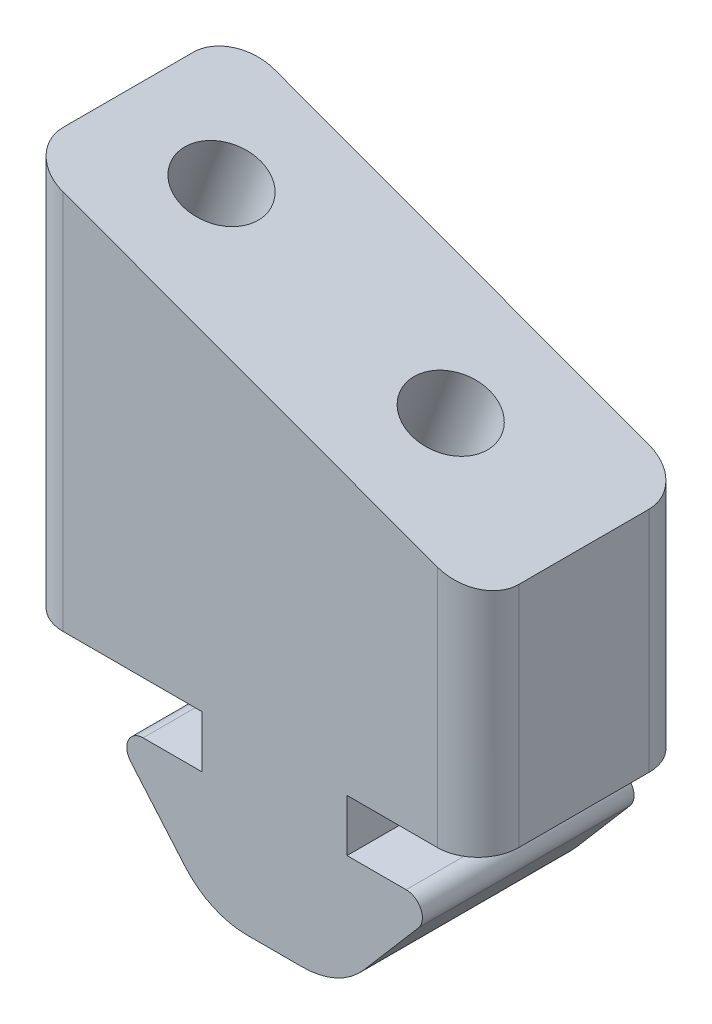
from build123d import *

# Parameters (mm, degrees)
BOSS_EXTRUDE3_DEPTH = 13
FILLET1_R           = 1
FILLET2_R           = 5
SKETCH2_R           = 2.4
CUT_EXTRUDE1_DEPTH  = 7.5
FILLET3_R           = 2.5


with BuildPart() as part:
    # Sketch1 → Boss-Extrude3 (new body)
    with BuildSketch(Plane.XY):
        Polygon((-12.5, 10.5), (-4.45, 10.5), (4.45, 10.5), (12.5, 10.5), (12.5, 24.5), (-12.5, 33.7), align=None)
        Polygon((-4.45, 7.3), (-10.25, 7.3), (-4, 0), (4, 0), (10.25, 7.3), (4.45, 7.3), (4.45, 10.5), (-4.45, 10.5), align=None)
        Polygon((-15.5, 34.804), (-12.5, 33.7), (-12.5, 10.5), (-15.5, 10.5), align=None)
    extrude(amount=BOSS_EXTRUDE3_DEPTH)

    # Fillet1
    fillet1_edges = [part.edges().sort_by_distance(p)[0] for p in [
        (10.25, 7.3, 6.5),
        (-10.25, 7.3, 6.5),
    ]]
    fillet(fillet1_edges, radius=FILLET1_R)

    # Fillet2
    fillet2_edges = [part.edges().sort_by_distance(p)[0] for p in [
        (4, 0, 6.5),
        (-4, 0, 6.5),
    ]]
    fillet(fillet2_edges, radius=FILLET2_R)

    # Sketch2 → Cut-Extrude1 (cut)
    with BuildSketch(Plane(origin=(9.431542754, 25.629192267, 0), x_dir=(0.9384712337524266, -0.3453574140208928, 0), z_dir=(0.3453574140208928, 0.9384712337524266, 0))):
        with Locations(Location((-20.450055857, -6.5, 0), (0, 0, 180))):
            Circle(SKETCH2_R)
        with Locations(Location((-5.450055857, -6.5, 0), (0, 0, 180))):
            Circle(SKETCH2_R)
    extrude(amount=-CUT_EXTRUDE1_DEPTH, mode=Mode.SUBTRACT)

    # Fillet3
    fillet3_edges = [part.edges().sort_by_distance(p)[0] for p in [
        (-15.5, 22.652, 13),
        (-15.5, 22.652, 0),
        (12.5, 17.5, 0),
        (12.5, 17.5, 13),
    ]]
    fillet(fillet3_edges, radius=FILLET3_R)


solid = part.part
